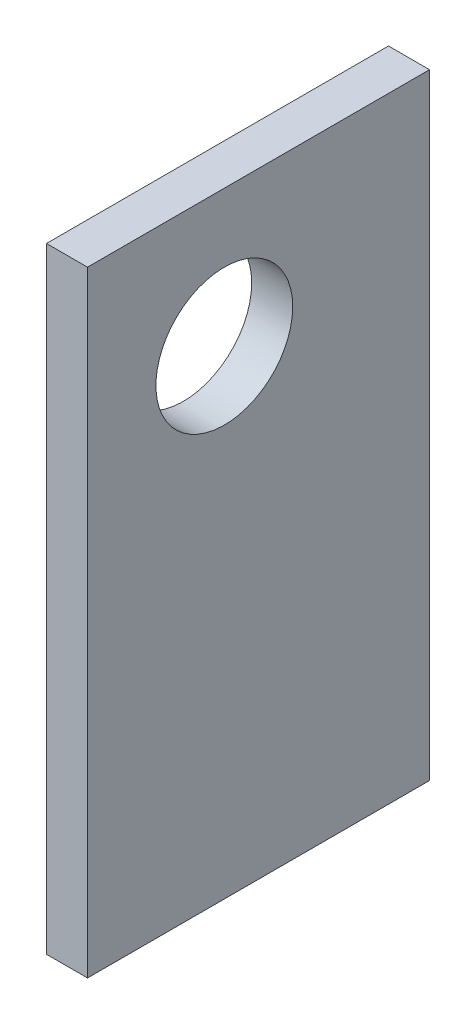
from build123d import *

# Parameters (mm, degrees)
SKETCH1_W           = 25
SKETCH1_H           = 45
BOSS_EXTRUDE1_DEPTH = 3
SKETCH2_R           = 5
CUT_EXTRUDE1_DEPTH  = 3


with BuildPart() as part:
    # Sketch1 → Boss-Extrude1 (new body)
    with BuildSketch(Plane(origin=(0, 0, 0), x_dir=(0, 0, -1), z_dir=(1, 0, 0))):
        Rectangle(SKETCH1_W, SKETCH1_H)
    extrude(amount=BOSS_EXTRUDE1_DEPTH)

    # Sketch2 → Cut-Extrude1 (cut)
    with BuildSketch(Plane(origin=(3, 0, 0), x_dir=(0, 0, -1), z_dir=(1, 0, 0))):
        with Locations((-2.5, 12.5)):
            Circle(SKETCH2_R)
    extrude(amount=-CUT_EXTRUDE1_DEPTH, mode=Mode.SUBTRACT)


solid = part.part
